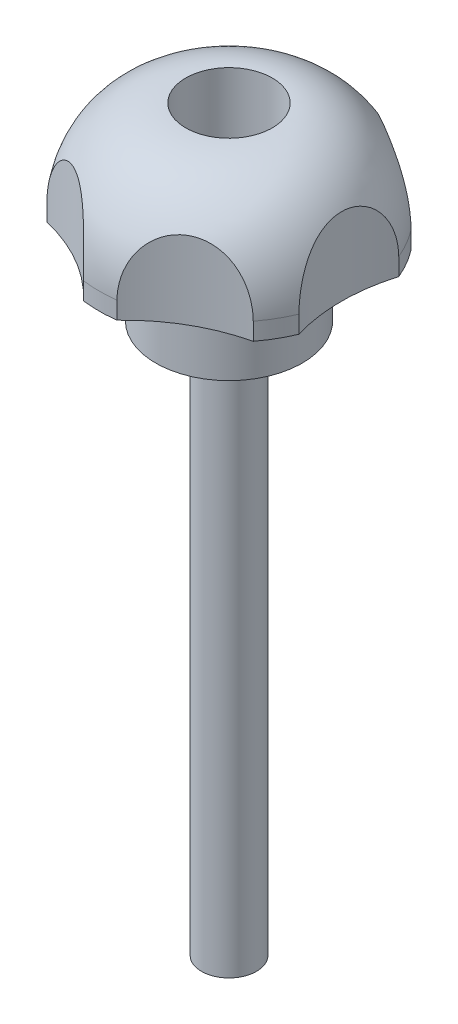
from build123d import *

# Parameters (mm, degrees)
CORTAR_EXTRUIR1_DEPTH = 113.54200331


with BuildPart() as part:
    # Croquis2 → Revolución1 (revolve)
    with BuildSketch(Plane.XY, mode=Mode.PRIVATE) as revoluci_n1_sk:
        with BuildLine():
            Line((4.7625, 95.25), (12.7, 95.25))
            Line((12.7, 95.25), (12.7, 112.95))
            add(Edge.make_bspline(
                [(12.7, 112.95), (18.502741551, 112.95), (18.502741551, 107.95)],
                knots=[0, 0, 0, 1, 1, 1], degree=2))
            Line((18.502741551, 107.95), (22.5, 107.95))
            Line((22.5, 107.95), (22.5, 110.964889394))
            add(Edge.make_bspline(
                [(7.5, 127.95), (17.074954072, 127.95), (22.5, 119.467155594), (22.5, 110.964889394)],
                knots=[0, 0, 0, 0, 1, 1, 1, 1], degree=3))
            Line((7.5, 127.95), (7.5, 115.25))
            Line((7.5, 115.25), (0, 115.25))
            Line((0, 115.25), (0, 0))
            Line((0, 0), (4.7625, 0))
            Line((4.7625, 0), (4.7625, 95.25))
        make_face()
    revolve(revoluci_n1_sk.sketch.rotate(Axis((0, 0, 0), (0, 1, 0)), 90), axis=Axis((0, 0, 0), (0, 1, 0)))

    # Croquis3 → Cortar-Extruir1 (cut, through all)
    with BuildSketch(Plane.XZ.offset(-107.95)):
        with BuildLine():
            ThreePointArc((20.772727273, 8.645449766), (19.5, 0), (20.772727273, -8.645449766))
            ThreePointArc((20.772727273, -8.645449766), (22.5, 0), (20.772727273, 8.645449766))
        make_face()
        with BuildLine():
            ThreePointArc((17.873542761, -13.666984641), (9.75, -16.887495374), (2.899184512, -22.312434407))
            ThreePointArc((2.899184512, -22.312434407), (11.25, -19.485571585), (17.873542761, -13.666984641))
        make_face()
        with BuildLine():
            ThreePointArc((-2.899184512, -22.312434407), (-9.75, -16.887495374), (-17.873542761, -13.666984641))
            ThreePointArc((-17.873542761, -13.666984641), (-11.25, -19.485571585), (-2.899184512, -22.312434407))
        make_face()
        with BuildLine():
            ThreePointArc((-20.772727273, -8.645449766), (-19.5, 0), (-20.772727273, 8.645449766))
            ThreePointArc((-20.772727273, 8.645449766), (-22.5, 0), (-20.772727273, -8.645449766))
        make_face()
        with BuildLine():
            ThreePointArc((-17.873542761, 13.666984641), (-9.75, 16.887495374), (-2.899184512, 22.312434407))
            ThreePointArc((-2.899184512, 22.312434407), (-11.25, 19.485571585), (-17.873542761, 13.666984641))
        make_face()
        with BuildLine():
            ThreePointArc((2.899184512, 22.312434407), (9.75, 16.887495374), (17.873542761, 13.666984641))
            ThreePointArc((17.873542761, 13.666984641), (11.25, 19.485571585), (2.899184512, 22.312434407))
        make_face()
    extrude(amount=-CORTAR_EXTRUIR1_DEPTH, mode=Mode.SUBTRACT)


solid = part.part
